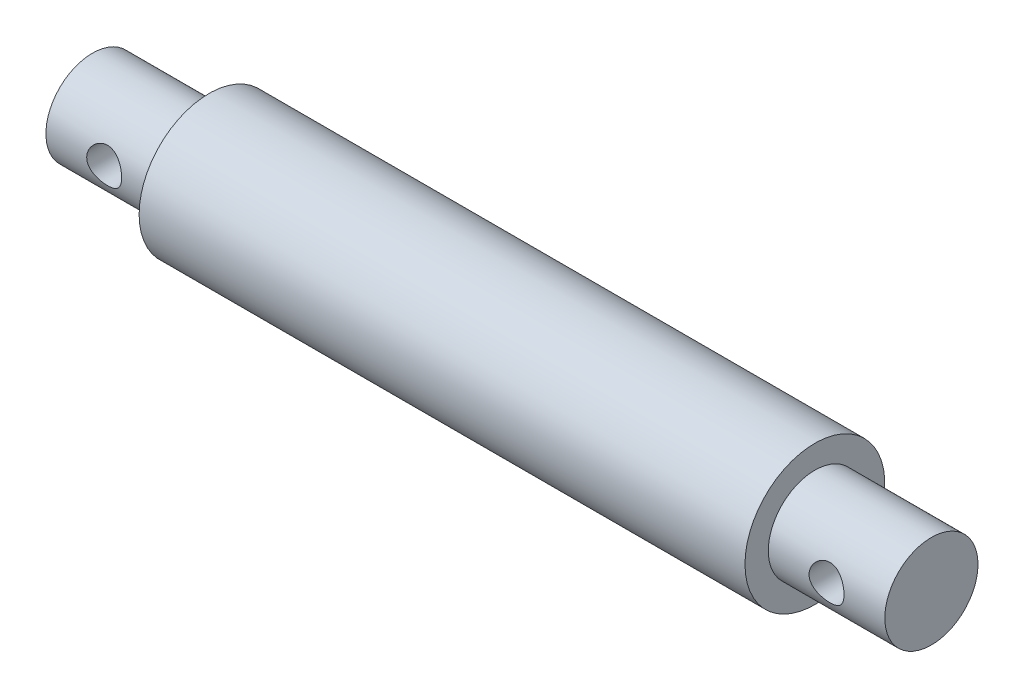
from build123d import *

# Parameters (mm, degrees)
SKETCH1_R           = 2
BOSS_EXTRUDE1_DEPTH = 5
SKETCH2_R           = 3
BOSS_EXTRUDE2_DEPTH = 26
SKETCH3_R           = 2
BOSS_EXTRUDE3_DEPTH = 5
SKETCH4_R           = 0.75
CUT_EXTRUDE1_DEPTH  = 2.5


with BuildPart() as part:
    # Sketch1 → Boss-Extrude1 (new body)
    with BuildSketch(Plane(origin=(0, 0, 0), x_dir=(0, 0, -1), z_dir=(1, 0, 0))):
        Circle(SKETCH1_R)
    extrude(amount=BOSS_EXTRUDE1_DEPTH)

    # Sketch2 → Boss-Extrude2 (add)
    with BuildSketch(Plane(origin=(5, 0, 0), x_dir=(0, 0, -1), z_dir=(1, 0, 0))):
        with Locations(Location((0, 0, 0), (0, 0, 180))):
            Circle(SKETCH2_R)
    extrude(amount=BOSS_EXTRUDE2_DEPTH)

    # Sketch3 → Boss-Extrude3 (add)
    with BuildSketch(Plane(origin=(31, 0, 0), x_dir=(0, 0, -1), z_dir=(1, 0, 0))):
        Circle(SKETCH3_R)
    extrude(amount=BOSS_EXTRUDE3_DEPTH)

    # Sketch4 → Cut-Extrude1 (cut, symmetric)
    with BuildSketch(Plane.XY):
        with Locations((33.5, 0)):
            Circle(SKETCH4_R)
        with Locations((2.5, 0)):
            Circle(SKETCH4_R)
    extrude(amount=CUT_EXTRUDE1_DEPTH, both=True, mode=Mode.SUBTRACT)


solid = part.part
